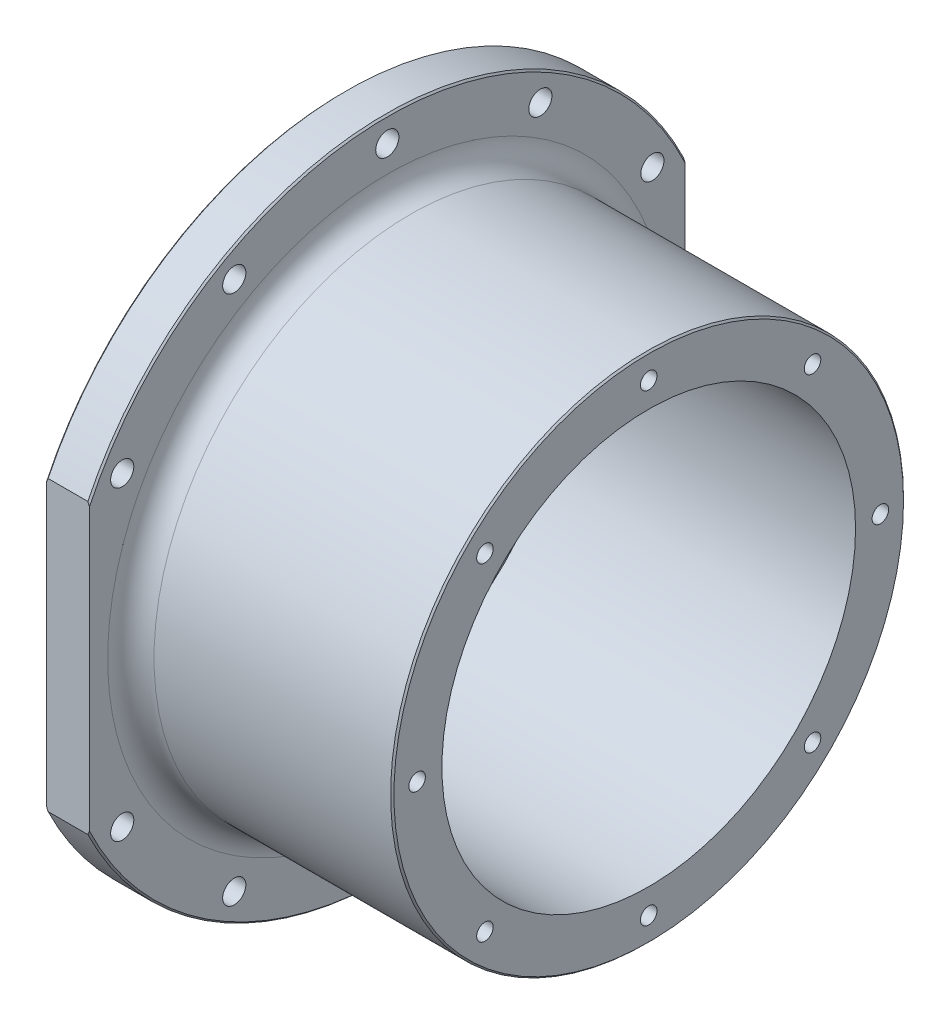
from build123d import *

# Parameters (mm, degrees)
CUT_EXTRUDE_1_REACH = 163.991
CUT_EXTRUDE_2_REACH = 164.985
SKETCH_5_R          = 3.5
SKETCH_6_R          = 2.5
CUT_EXTRUDE_3_DEPTH = 15
FILLET_1_R          = 7
CHAMFER_1_SIZE      = 0.5


with BuildPart() as part:
    # 草图1 → 旋转1 (revolve)
    with BuildSketch(Plane.XY, mode=Mode.PRIVATE) as revolve_1_sk:
        Polygon((0, 0), (0, 85), (5, 85), (5, 100), (18, 100), (18, 77.5), (97, 77.5), (97, 0), align=None)
    revolve(revolve_1_sk.sketch.rotate(Axis((0, 0, 0), (-1, 0, 0)), 90), axis=Axis((0, 0, 0), (-1, 0, 0)))

    # 草图3 → 切除-旋转1 (revolve, cut)
    with BuildSketch(Plane.XY, mode=Mode.PRIVATE) as cut_revolve_1_sk:
        Polygon((0, 0), (0, 57.5), (9, 57.5), (9, 62.5), (97, 62.5), (97, 0), align=None)
    revolve(cut_revolve_1_sk.sketch.rotate(Axis((97, 0, 0), (-1, 0, 0)), 90), axis=Axis((97, 0, 0), (-1, 0, 0)), mode=Mode.SUBTRACT)

    # 草图4 → 切除-拉伸1 (cut, up to next)
    with BuildSketch(Plane(origin=(18, 0, 0), x_dir=(0, 0, -1), z_dir=(1, 0, 0)), mode=Mode.PRIVATE) as cut_extrude_1_sk1:
        with BuildLine():
            Line((-90, 43.588989435), (-90, -43.588989435))
            ThreePointArc((-90, -43.588989435), (-100, 0), (-90, 43.588989435))
        make_face()
    cut_extrude_1_tool1 = extrude(cut_extrude_1_sk1.sketch, amount=-CUT_EXTRUDE_1_REACH, mode=Mode.PRIVATE) & part.part
    # 草图4 → 切除-拉伸1 (cut, up to next)
    with BuildSketch(Plane(origin=(18, 0, 0), x_dir=(0, 0, -1), z_dir=(1, 0, 0)), mode=Mode.PRIVATE) as cut_extrude_1_sk2:
        with BuildLine():
            Line((90, 43.588989435), (90, -43.588989435))
            ThreePointArc((90, -43.588989435), (100, 0), (90, 43.588989435))
        make_face()
    cut_extrude_1_tool2 = extrude(cut_extrude_1_sk2.sketch, amount=-CUT_EXTRUDE_1_REACH, mode=Mode.PRIVATE) & part.part
    add(cut_extrude_1_tool1.solids().sort_by_distance((18, 0, 94.017654))[0], mode=Mode.SUBTRACT)
    add(cut_extrude_1_tool2.solids().sort_by_distance((18, 0, -94.017654))[0], mode=Mode.SUBTRACT)

    # 草图5 → 切除-拉伸2 (cut, up to next)
    with BuildSketch(Plane.ZY.offset(-5), mode=Mode.PRIVATE) as cut_extrude_2_sk1:
        with Locations((0, 92.5)):
            Circle(SKETCH_5_R)
    cut_extrude_2_tool1 = extrude(cut_extrude_2_sk1.sketch, amount=-CUT_EXTRUDE_2_REACH, mode=Mode.PRIVATE) & part.part
    # 草图5 → 切除-拉伸2 (cut, up to next)
    with BuildSketch(Plane.ZY.offset(-5), mode=Mode.PRIVATE) as cut_extrude_2_sk2:
        with Locations((46.25, 80.10734985)):
            Circle(SKETCH_5_R)
    cut_extrude_2_tool2 = extrude(cut_extrude_2_sk2.sketch, amount=-CUT_EXTRUDE_2_REACH, mode=Mode.PRIVATE) & part.part
    # 草图5 → 切除-拉伸2 (cut, up to next)
    with BuildSketch(Plane.ZY.offset(-5), mode=Mode.PRIVATE) as cut_extrude_2_sk3:
        with Locations((80.10734985, 46.25)):
            Circle(SKETCH_5_R)
    cut_extrude_2_tool3 = extrude(cut_extrude_2_sk3.sketch, amount=-CUT_EXTRUDE_2_REACH, mode=Mode.PRIVATE) & part.part
    # 草图5 → 切除-拉伸2 (cut, up to next)
    with BuildSketch(Plane.ZY.offset(-5), mode=Mode.PRIVATE) as cut_extrude_2_sk4:
        with Locations((80.10734985, -46.25)):
            Circle(SKETCH_5_R)
    cut_extrude_2_tool4 = extrude(cut_extrude_2_sk4.sketch, amount=-CUT_EXTRUDE_2_REACH, mode=Mode.PRIVATE) & part.part
    # 草图5 → 切除-拉伸2 (cut, up to next)
    with BuildSketch(Plane.ZY.offset(-5), mode=Mode.PRIVATE) as cut_extrude_2_sk5:
        with Locations((46.25, -80.10734985)):
            Circle(SKETCH_5_R)
    cut_extrude_2_tool5 = extrude(cut_extrude_2_sk5.sketch, amount=-CUT_EXTRUDE_2_REACH, mode=Mode.PRIVATE) & part.part
    # 草图5 → 切除-拉伸2 (cut, up to next)
    with BuildSketch(Plane.ZY.offset(-5), mode=Mode.PRIVATE) as cut_extrude_2_sk6:
        with Locations((0, -92.5)):
            Circle(SKETCH_5_R)
    cut_extrude_2_tool6 = extrude(cut_extrude_2_sk6.sketch, amount=-CUT_EXTRUDE_2_REACH, mode=Mode.PRIVATE) & part.part
    # 草图5 → 切除-拉伸2 (cut, up to next)
    with BuildSketch(Plane.ZY.offset(-5), mode=Mode.PRIVATE) as cut_extrude_2_sk7:
        with Locations((-46.25, -80.10734985)):
            Circle(SKETCH_5_R)
    cut_extrude_2_tool7 = extrude(cut_extrude_2_sk7.sketch, amount=-CUT_EXTRUDE_2_REACH, mode=Mode.PRIVATE) & part.part
    # 草图5 → 切除-拉伸2 (cut, up to next)
    with BuildSketch(Plane.ZY.offset(-5), mode=Mode.PRIVATE) as cut_extrude_2_sk8:
        with Locations((-80.10734985, -46.25)):
            Circle(SKETCH_5_R)
    cut_extrude_2_tool8 = extrude(cut_extrude_2_sk8.sketch, amount=-CUT_EXTRUDE_2_REACH, mode=Mode.PRIVATE) & part.part
    # 草图5 → 切除-拉伸2 (cut, up to next)
    with BuildSketch(Plane.ZY.offset(-5), mode=Mode.PRIVATE) as cut_extrude_2_sk9:
        with Locations((-80.10734985, 46.25)):
            Circle(SKETCH_5_R)
    cut_extrude_2_tool9 = extrude(cut_extrude_2_sk9.sketch, amount=-CUT_EXTRUDE_2_REACH, mode=Mode.PRIVATE) & part.part
    # 草图5 → 切除-拉伸2 (cut, up to next)
    with BuildSketch(Plane.ZY.offset(-5), mode=Mode.PRIVATE) as cut_extrude_2_sk10:
        with Locations((-46.25, 80.10734985)):
            Circle(SKETCH_5_R)
    cut_extrude_2_tool10 = extrude(cut_extrude_2_sk10.sketch, amount=-CUT_EXTRUDE_2_REACH, mode=Mode.PRIVATE) & part.part
    add(cut_extrude_2_tool1.solids().sort_by_distance((5, 92.5, 0))[0], mode=Mode.SUBTRACT)
    add(cut_extrude_2_tool2.solids().sort_by_distance((5, 80.10735, 46.25))[0], mode=Mode.SUBTRACT)
    add(cut_extrude_2_tool3.solids().sort_by_distance((5, 46.25, 80.10735))[0], mode=Mode.SUBTRACT)
    add(cut_extrude_2_tool4.solids().sort_by_distance((5, -46.25, 80.10735))[0], mode=Mode.SUBTRACT)
    add(cut_extrude_2_tool5.solids().sort_by_distance((5, -80.10735, 46.25))[0], mode=Mode.SUBTRACT)
    add(cut_extrude_2_tool6.solids().sort_by_distance((5, -92.5, 0))[0], mode=Mode.SUBTRACT)
    add(cut_extrude_2_tool7.solids().sort_by_distance((5, -80.10735, -46.25))[0], mode=Mode.SUBTRACT)
    add(cut_extrude_2_tool8.solids().sort_by_distance((5, -46.25, -80.10735))[0], mode=Mode.SUBTRACT)
    add(cut_extrude_2_tool9.solids().sort_by_distance((5, 46.25, -80.10735))[0], mode=Mode.SUBTRACT)
    add(cut_extrude_2_tool10.solids().sort_by_distance((5, 80.10735, -46.25))[0], mode=Mode.SUBTRACT)

    # 草图6 → 切除-拉伸3 (cut)
    with BuildSketch(Plane(origin=(97, 0, 0), x_dir=(0, 0, -1), z_dir=(1, 0, 0))):
        with Locations((0, 70)):
            Circle(SKETCH_6_R)
        with Locations((49.497474683, 49.497474683)):
            Circle(SKETCH_6_R)
        with Locations((70, 0)):
            Circle(SKETCH_6_R)
        with Locations((49.497474683, -49.497474683)):
            Circle(SKETCH_6_R)
        with Locations((0, -70)):
            Circle(SKETCH_6_R)
        with Locations((-49.497474683, -49.497474683)):
            Circle(SKETCH_6_R)
        with Locations((-70, 0)):
            Circle(SKETCH_6_R)
        with Locations((-49.497474683, 49.497474683)):
            Circle(SKETCH_6_R)
    extrude(amount=-CUT_EXTRUDE_3_DEPTH, mode=Mode.SUBTRACT)

    # 圆角1
    fillet_1_edges = [part.edges().sort_by_distance(p)[0] for p in [
        (18, 0, 77.5),
    ]]
    fillet(fillet_1_edges, radius=FILLET_1_R)

    # 倒角1
    chamfer_1_edges = [part.edges().sort_by_distance(p)[0] for p in [
        (18, -100, 0),
        (5, -100, 0),
        (97, 0, 77.5),
        (18, 100, 0),
        (5, 100, 0),
    ]]
    chamfer(chamfer_1_edges, length=CHAMFER_1_SIZE)


solid = part.part
